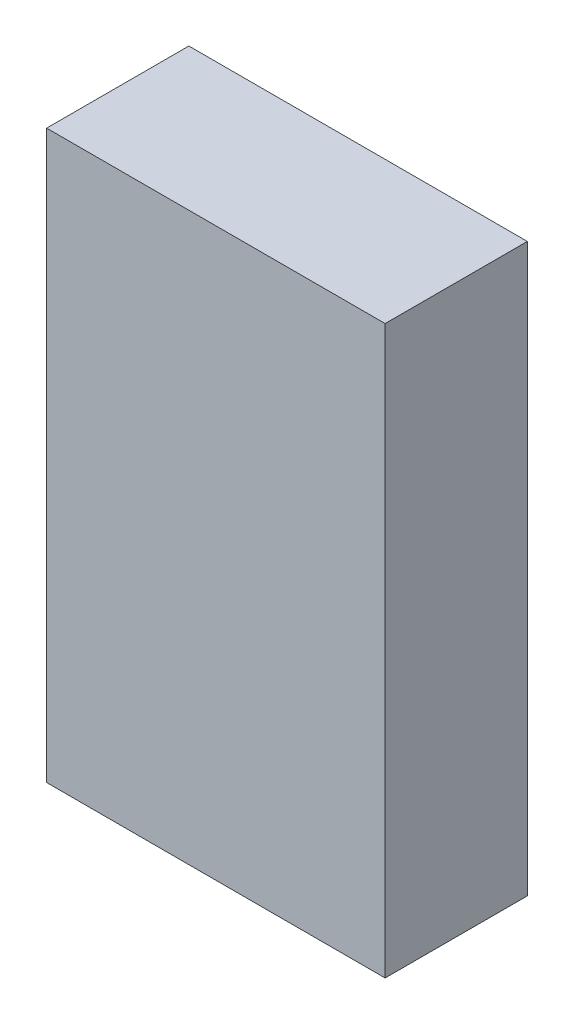
from build123d import *

# Parameters (mm, degrees)
SKETCH1_W           = 109.22
SKETCH1_H           = 182.88
BOSS_EXTRUDE1_DEPTH = 45.892618238


with BuildPart() as part:
    # Sketch1 → Boss-Extrude1 (new body)
    with BuildSketch(Plane.XY):
        Rectangle(SKETCH1_W, SKETCH1_H)
    extrude(amount=BOSS_EXTRUDE1_DEPTH)


solid = part.part
